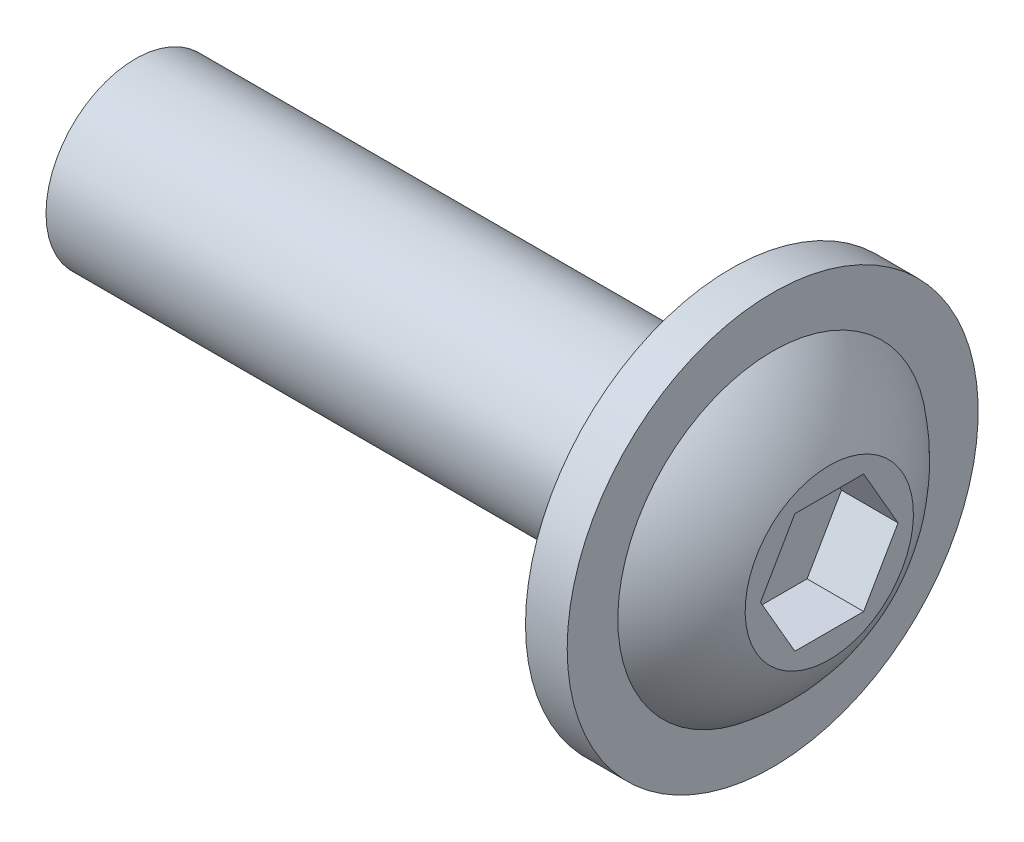
from build123d import *

# Parameters (mm, degrees)
CUT_EXTRUDE1_DEPTH = 0.95


with BuildPart() as part:
    # Sketch1 → Revolve1 (revolve)
    with BuildSketch(Plane.XY, mode=Mode.PRIVATE) as revolve1_sk:
        with BuildLine():
            Line((0, 0), (0, 1.412884895))
            ThreePointArc((0, 1.412884895), (-0.405699108, 2.061901136), (-0.95, 2.6))
            Line((-0.95, 2.6), (-0.95, 3.45))
            Line((-0.95, 3.45), (-1.65, 3.45))
            Line((-1.65, 3.45), (-1.65, 1.5))
            Line((-1.65, 1.5), (-11.65, 1.5))
            Line((-11.65, 1.5), (-11.65, 0))
            Line((-11.65, 0), (0, 0))
        make_face()
    revolve(revolve1_sk.sketch.rotate(Axis((0, 0, 0), (1, 0, 0)), 90), axis=Axis((0, 0, 0), (1, 0, 0)))

    # Sketch2 → Cut-Extrude1 (cut)
    with BuildSketch(Plane(origin=(0, 0, 0), x_dir=(0, 0, -1), z_dir=(1, 0, 0))):
        Polygon((1.154700538, 0), (0.577350269, 1), (-0.577350269, 1), (-1.154700538, 0), (-0.577350269, -1), (0.577350269, -1), align=None)
    extrude(amount=-CUT_EXTRUDE1_DEPTH, mode=Mode.SUBTRACT)


solid = part.part
